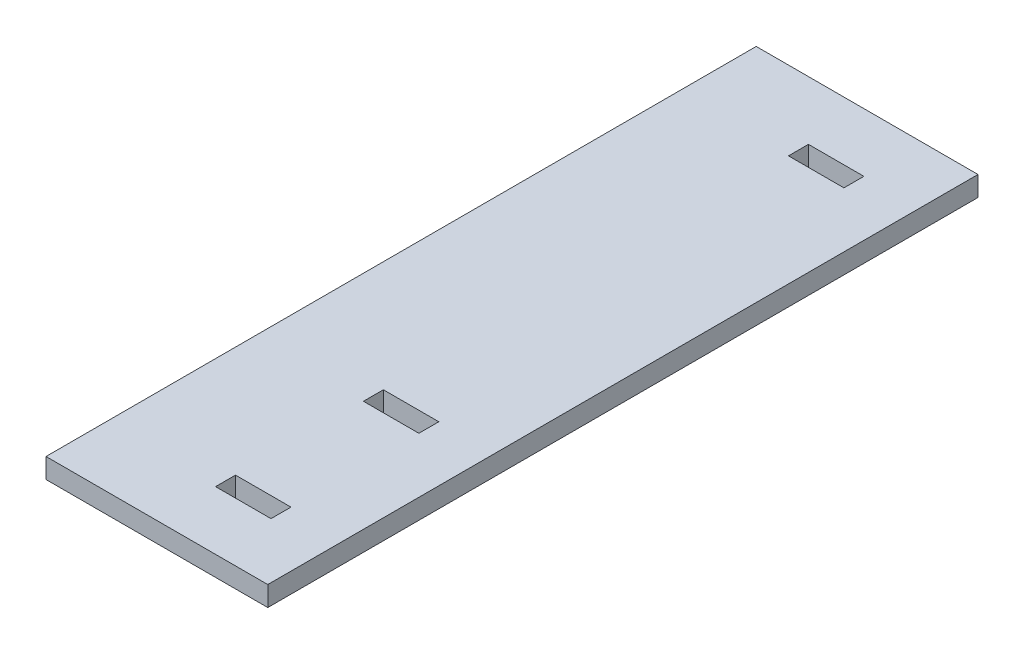
from build123d import *

# Parameters (mm, degrees)
SKETCH1_W   = 30
SKETCH1_H   = 96.075
SKETCH1_W_2 = 7.5
SKETCH1_H_2 = 2.7
BASE_DEPTH  = 2.7


with BuildPart() as part:
    # Sketch1 → Base (new body)
    with BuildSketch(Plane(origin=(0, 0, 0), x_dir=(1, 0, 0), z_dir=(0, 1, 0))):
        with Locations((-45, 18.75)):
            Rectangle(SKETCH1_W, SKETCH1_H)
        with Locations((-41.25, 0)):
            Rectangle(SKETCH1_W_2, SKETCH1_H_2, mode=Mode.SUBTRACT)
        with Locations((-41.25, 57.5)):
            Rectangle(SKETCH1_W_2, SKETCH1_H_2, mode=Mode.SUBTRACT)
        with Locations((-41.25, -20)):
            Rectangle(SKETCH1_W_2, SKETCH1_H_2, mode=Mode.SUBTRACT)
    extrude(amount=BASE_DEPTH)


solid = part.part
